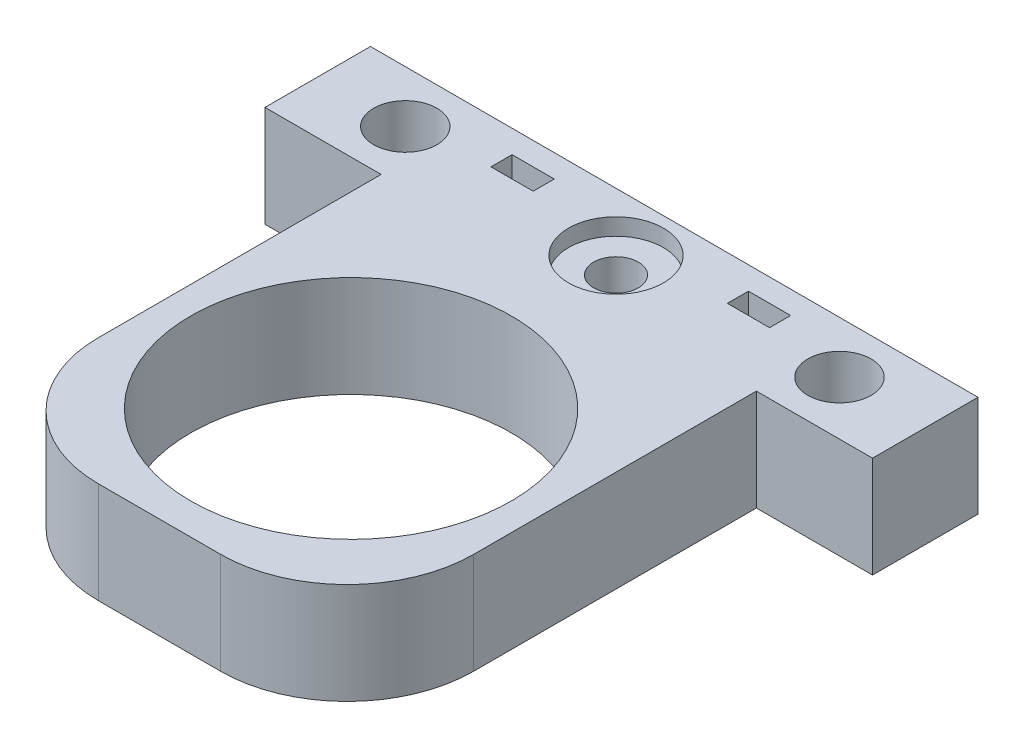
from build123d import *

# Parameters (mm, degrees)
BOSS_EXTRUDE1_DEPTH = 60
SKETCH2_R           = 7.5
CUT_EXTRUDE1_DEPTH  = 60
SKETCH3_R           = 5.25
CUT_EXTRUDE2_DEPTH  = 60
SKETCH4_R           = 11.5
CUT_EXTRUDE3_DEPTH  = 4
SKETCH5_W           = 10
SKETCH5_H           = 5
CUT_EXTRUDE4_DEPTH  = 60
SKETCH6_W           = 130
SKETCH6_H           = 90
BOSS_EXTRUDE2_DEPTH = 60
SKETCH8_W           = 130
SKETCH8_H           = 115
CUT_EXTRUDE6_DEPTH  = 20
SKETCH9_W           = 20.525641278
SKETCH9_H           = 90
CUT_EXTRUDE7_DEPTH  = 45
SKETCH7_R           = 38.5
CUT_EXTRUDE8_DEPTH  = 40
SKETCH12_W          = 88.948717444
SKETCH12_H          = 40
BOSS_EXTRUDE4_DEPTH = 7
SKETCH13_W          = 25
SKETCH13_H          = 40
BOSS_EXTRUDE5_DEPTH = 7
SKETCH14_W          = 25
SKETCH14_H          = 40
BOSS_EXTRUDE6_DEPTH = 7
SKETCH16_W          = 144.296296296
SKETCH16_H          = 122.248772368
CUT_EXTRUDE9_DEPTH  = 16
SKETCH23_R          = 10.574878896
BOSS_EXTRUDE7_DEPTH = 24
SKETCH24_R          = 5.3
CUT_EXTRUDE11_DEPTH = 24
SKETCH25_R          = 11.25
CUT_EXTRUDE12_DEPTH = 4
SKETCH26_R          = 41.241524366
BOSS_EXTRUDE8_DEPTH = 24
SKETCH27_R          = 38
CUT_EXTRUDE13_DEPTH = 24
FILLET2_R           = 30


with BuildPart() as part:
    # Sketch1 → Boss-Extrude1 (new body)
    with BuildSketch(Plane(origin=(0, 0, 0), x_dir=(1, 0, 0), z_dir=(0, 1, 0))):
        with BuildLine():
            Line((-65, 25), (65, 25))
            Line((65, 25), (65, -25))
            Line((65, -25), (32.897568299, -25))
            ThreePointArc((32.897568299, -25), (0, -6.5), (-32.897568299, -25))
            Line((-32.897568299, -25), (-65, -25))
            Line((-65, -25), (-65, 25))
        make_face()
    extrude(amount=BOSS_EXTRUDE1_DEPTH)

    # Sketch2 → Cut-Extrude1 (cut)
    with BuildSketch(Plane(origin=(0, 60, 0), x_dir=(1, 0, 0), z_dir=(0, 1, 0))):
        with Locations(Location((-51.452605548, 12.714222387, 0), (0, 0, 270))):
            Circle(SKETCH2_R)
        with Locations(Location((51.452605548, 12.714222387, 0), (0, 0, 90))):
            Circle(SKETCH2_R)
    extrude(amount=-CUT_EXTRUDE1_DEPTH, mode=Mode.SUBTRACT)

    # Sketch3 → Cut-Extrude2 (cut)
    with BuildSketch(Plane(origin=(0, 60, 0), x_dir=(1, 0, 0), z_dir=(0, 1, 0))):
        with Locations(Location((0, 12.714222387, 0), (0, 0, 270))):
            Circle(SKETCH3_R)
    extrude(amount=-CUT_EXTRUDE2_DEPTH, mode=Mode.SUBTRACT)

    # Sketch4 → Cut-Extrude3 (cut)
    with BuildSketch(Plane(origin=(0, 60, 0), x_dir=(1, 0, 0), z_dir=(0, 1, 0))):
        with Locations(Location((0, 12.714222387, 0), (0, 0, 270))):
            Circle(SKETCH4_R)
    extrude(amount=-CUT_EXTRUDE3_DEPTH, mode=Mode.SUBTRACT)

    # Sketch5 → Cut-Extrude4 (cut)
    with BuildSketch(Plane(origin=(0, 60, 0), x_dir=(1, 0, 0), z_dir=(0, 1, 0))):
        with Locations((-52.884181241, -16.580341224)):
            Rectangle(SKETCH5_W, SKETCH5_H)
        with Locations((-28.013085243, 17.079406564)):
            Rectangle(SKETCH5_W, SKETCH5_H)
        with Locations((52.884181241, -16.580341224)):
            Rectangle(SKETCH5_W, SKETCH5_H)
        with Locations((28.013085243, 17.079406564)):
            Rectangle(SKETCH5_W, SKETCH5_H)
    extrude(amount=-CUT_EXTRUDE4_DEPTH, mode=Mode.SUBTRACT)

    # Sketch6 → Boss-Extrude2 (add)
    with BuildSketch(Plane(origin=(0, 60, 0), x_dir=(1, 0, 0), z_dir=(0, 1, 0))):
        with Locations((0, -45)):
            Rectangle(SKETCH6_W, SKETCH6_H)
    extrude(amount=-BOSS_EXTRUDE2_DEPTH)

    # Sketch8 → Cut-Extrude6 (cut)
    with BuildSketch(Plane.XZ):
        with Locations((0, 32.5)):
            Rectangle(SKETCH8_W, SKETCH8_H)
    extrude(amount=-CUT_EXTRUDE6_DEPTH, mode=Mode.SUBTRACT)

    # Sketch9 → Cut-Extrude7 (cut)
    with BuildSketch(Plane(origin=(0, 60, 0), x_dir=(1, 0, 0), z_dir=(0, 1, 0))):
        with Locations((-54.737179361, -45)):
            Rectangle(SKETCH9_W, SKETCH9_H)
        with Locations((54.737179361, -45)):
            Rectangle(SKETCH9_W, SKETCH9_H)
    extrude(amount=-CUT_EXTRUDE7_DEPTH, mode=Mode.SUBTRACT)

    # Sketch7 → Cut-Extrude8 (cut)
    with BuildSketch(Plane(origin=(0, 60, 0), x_dir=(1, 0, 0), z_dir=(0, 1, 0))):
        with Locations(Location((0, -51.285777613, 0), (0, 0, 270))):
            Circle(SKETCH7_R)
    extrude(amount=-CUT_EXTRUDE8_DEPTH, mode=Mode.SUBTRACT)

    # Sketch12 → Boss-Extrude4 (add)
    with BuildSketch(Plane.XY.offset(90)):
        with Locations((0, 40)):
            Rectangle(SKETCH12_W, SKETCH12_H)
    extrude(amount=BOSS_EXTRUDE4_DEPTH)

    # Sketch13 → Boss-Extrude5 (add)
    with BuildSketch(Plane(origin=(65, 0, 0), x_dir=(0, 0, -1), z_dir=(1, 0, 0))):
        with Locations((12.5, 40)):
            Rectangle(SKETCH13_W, SKETCH13_H)
    extrude(amount=BOSS_EXTRUDE5_DEPTH)

    # Sketch14 → Boss-Extrude6 (add)
    with BuildSketch(Plane.ZY.offset(65)):
        with Locations((-12.5, 40)):
            Rectangle(SKETCH14_W, SKETCH14_H)
    extrude(amount=BOSS_EXTRUDE6_DEPTH)

    # Sketch16 → Cut-Extrude9 (cut)
    with BuildSketch(Plane(origin=(0, 60, 0), x_dir=(1, 0, 0), z_dir=(0, 1, 0))):
        with Locations((0.148148148, -36.124386184)):
            Rectangle(SKETCH16_W, SKETCH16_H)
    extrude(amount=-CUT_EXTRUDE9_DEPTH, mode=Mode.SUBTRACT)

    # Sketch23 → Boss-Extrude7 (add)
    with BuildSketch(Plane(origin=(0, 44, 0), x_dir=(1, 0, 0), z_dir=(0, 1, 0))):
        with Locations((0, 12.714222387)):
            Circle(SKETCH23_R)
    extrude(amount=-BOSS_EXTRUDE7_DEPTH)

    # Sketch24 → Cut-Extrude11 (cut)
    with BuildSketch(Plane(origin=(0, 44, 0), x_dir=(1, 0, 0), z_dir=(0, 1, 0))):
        with Locations(Location((0, 11.2, 0), (0, 0, 270))):
            Circle(SKETCH24_R)
    extrude(amount=-CUT_EXTRUDE11_DEPTH, mode=Mode.SUBTRACT)

    # Sketch25 → Cut-Extrude12 (cut)
    with BuildSketch(Plane(origin=(0, 44, 0), x_dir=(1, 0, 0), z_dir=(0, 1, 0))):
        with Locations(Location((0, 11.2, 0), (0, 0, 270))):
            Circle(SKETCH25_R)
    extrude(amount=-CUT_EXTRUDE12_DEPTH, mode=Mode.SUBTRACT)

    # Sketch26 → Boss-Extrude8 (add)
    with BuildSketch(Plane(origin=(0, 44, 0), x_dir=(1, 0, 0), z_dir=(0, 1, 0))):
        with Locations((0, -51.285777613)):
            Circle(SKETCH26_R)
    extrude(amount=-BOSS_EXTRUDE8_DEPTH)

    # Sketch27 → Cut-Extrude13 (cut)
    with BuildSketch(Plane(origin=(0, 44, 0), x_dir=(1, 0, 0), z_dir=(0, 1, 0))):
        with Locations(Location((0, -51.59650437, 0), (0, 0, 270))):
            Circle(SKETCH27_R)
    extrude(amount=-CUT_EXTRUDE13_DEPTH, mode=Mode.SUBTRACT)

    # Fillet2
    fillet2_edges = [part.edges().sort_by_distance(p)[0] for p in [
        (44.474358722, 32, 97),
        (-44.474358722, 32, 97),
    ]]
    fillet(fillet2_edges, radius=FILLET2_R)


solid = part.part
